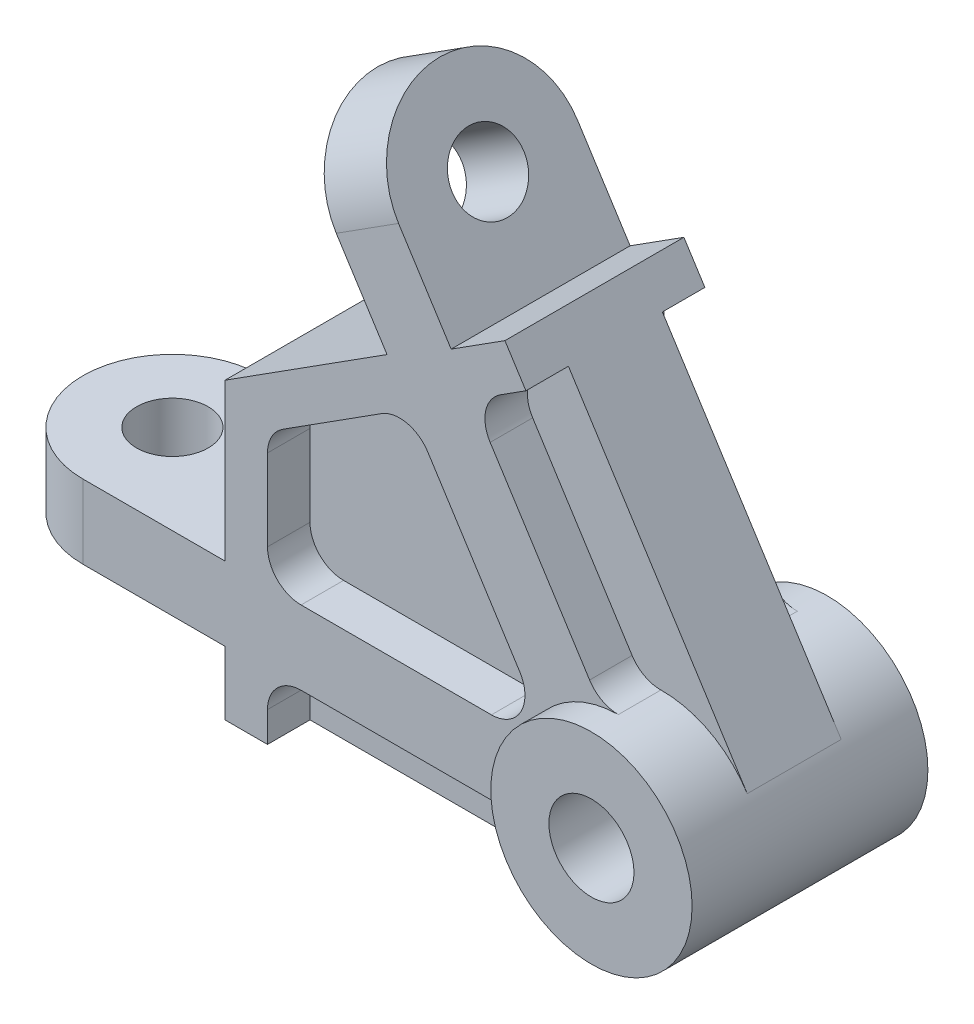
from build123d import *

# Parameters (mm, degrees)
SKETCH1_R               = 9.499999999999995
BOSS_EXTRUDE1_DEPTH     = 26.35
BOSS_EXTRUDE2_DEPTH     = 20
BOSS_EXTRUDE3_DEPTH     = 10.5
CUT_EXTRUDE1_DEPTH      = 180.89665532608137
CUT_EXTRUDE1_DEPTH_BACK = 180.89665532608137
SKETCH2_R               = 7.999999999999998
CUT_EXTRUDE2_DEPTH      = 183.77082750646198
CUT_EXTRUDE2_DEPTH_BACK = 183.77082750646198
SKETCH4_R               = 7.999999999999996


with BuildPart() as part:
    # Sketch1 → Boss-Extrude1 (new, symmetric)
    with BuildSketch(Plane.XY):
        with BuildLine():
            ThreePointArc((22.5, 0), (21.601121723683402, 6.296152815697305), (18.976307530789946, 12.089241187803507))
            ThreePointArc((18.976307530789946, 12.089241187803507), (10.67878079531028, 19.804384381386672), (-0.3266186383022837, 22.49762921432197))
            ThreePointArc((-0.3266186383022837, 22.49762921432197), (-19.726352003418917, 10.82224730068624), (-19.14980009686784, -11.812500000000023))
            ThreePointArc((-19.149800096867843, -11.812500000000012), (-10.965143637910074, -19.64728034614461), (-4.13e-15, -22.5))
            ThreePointArc((-4.13e-15, -22.5), (15.909902576697315, -15.909902576697323), (22.5, -5.51e-15))
        make_face()
        Circle(SKETCH1_R, mode=Mode.SUBTRACT)
    extrude(amount=BOSS_EXTRUDE1_DEPTH, both=True)

    # Sketch1<3> → Boss-Extrude2 (add, symmetric)
    with BuildSketch(Plane.XY):
        with BuildLine():
            Line((-26.68811354451123, 71.20520110937484), (-20.99522128527427, 74.83197346571588))
            Line((-20.995221285274297, 74.83197346571585), (-25.68506516240018, 82.19355375857313))
            Line((-25.68506516240017, 82.19355375857313), (-37.70339326523374, 74.53703433963095))
            Line((-37.70339326523374, 74.53703433963095), (-60.20447161539646, 109.85665249547212))
            Line((-60.20447161539646, 109.85665249547212), (-74.12043047130908, 100.99120895774956))
            Line((-74.12043047130908, 100.99120895774956), (-52.033854523315306, 66.32222924427353))
            Line((-52.033854523315306, 66.32222924427353), (-88.25, 43.25))
            Line((-88.25, 43.25), (-88.25000000000001, 8.249999999999986))
            Line((-88.25000000000001, 8.24999999999999), (-140, 8.249999999999982))
            Line((-140, 8.249999999999982), (-140, -8.250000000000018))
            Line((-140, -8.250000000000018), (-88.25000000000001, -8.25000000000001))
            Line((-88.25000000000001, -8.25000000000001), (-88.24999999999999, -22.5))
            Line((-88.24999999999999, -22.5), (-78.74999999999999, -22.5))
            Line((-78.74999999999999, -22.5), (-78.75, -15.750000000000018))
            ThreePointArc((-78.75, -15.750000000000018), (-76.5533008588991, -10.44669914110092), (-71.25000000000001, -8.250000000000018))
            Line((-71.25000000000001, -8.250000000000018), (-25.533066795823785, -8.250000000000018))
            ThreePointArc((-25.53306679582379, -8.250000000000018), (-21.878018916520432, -9.200906551285149), (-19.149800096867843, -11.812500000000014))
            ThreePointArc((-19.14980009686784, -11.812500000000023), (-19.726352003418917, 10.82224730068624), (-0.3266186383022837, 22.49762921432197))
            ThreePointArc((-0.3266186383022812, 22.497629214321968), (-3.99508511617313, 23.395377491967075), (-6.7609273613330165, 25.967091889828126))
            Line((-6.760927361333014, 25.967091889828126), (-28.98380232550672, 60.850018203177015))
            ThreePointArc((-28.983802325506723, 60.850018203177015), (-29.980586535309566, 66.50306237031397), (-26.688113544511225, 71.20520110937484))
        make_face()
        with BuildLine():
            ThreePointArc((-53.25494408761715, 54.28026344644994), (-47.60189992048019, 55.27704765625279), (-42.89976118141933, 51.98457466545446))
            Line((-42.89976118141933, 51.98457466545446), (-22.38302326120931, 19.77974706260116))
            ThreePointArc((-22.383023261209313, 19.77974706260116), (-22.13300843699966, 12.142584233104584), (-28.70845910480596, 8.25))
            Line((-28.70845910480596, 8.249999999999998), (-71.25000000000001, 8.249999999999991))
            ThreePointArc((-71.25000000000001, 8.249999999999993), (-76.55330085889912, 10.446699141100883), (-78.75, 15.749999999999993))
            Line((-78.75, 15.749999999999993), (-78.75, 33.92348062734661))
            ThreePointArc((-78.75, 33.92348062734661), (-77.82545066780631, 37.53089639424201), (-75.27974706260119, 40.24891647094325))
            Line((-75.27974706260119, 40.24891647094325), (-53.25494408761715, 54.28026344644994))
        make_face(mode=Mode.SUBTRACT)
    extrude(amount=BOSS_EXTRUDE2_DEPTH, both=True)

    # Sketch1<4> → Boss-Extrude3 (add, symmetric)
    with BuildSketch(Plane.XY):
        with BuildLine():
            ThreePointArc((-0.3266186383022837, 22.49762921432197), (10.67878079531028, 19.804384381386672), (18.976307530789946, 12.089241187803507))
            Line((18.976307530789953, 12.08924118780351), (-20.995221285274297, 74.83197346571585))
            Line((-20.99522128527427, 74.83197346571588), (-26.68811354451123, 71.20520110937484))
            ThreePointArc((-26.688113544511225, 71.20520110937484), (-29.980586535309566, 66.50306237031397), (-28.983802325506723, 60.850018203177015))
            Line((-28.98380232550672, 60.850018203177015), (-6.760927361333014, 25.967091889828126))
            ThreePointArc((-6.7609273613330165, 25.967091889828126), (-3.99508511617313, 23.395377491967075), (-0.3266186383022812, 22.497629214321968))
        make_face()
        with BuildLine():
            Line((-78.74999999999999, -22.5), (0, -22.5))
            ThreePointArc((-4.13e-15, -22.5), (-10.965143637910074, -19.64728034614461), (-19.149800096867843, -11.812500000000012))
            ThreePointArc((-19.149800096867843, -11.812500000000014), (-21.878018916520432, -9.200906551285149), (-25.53306679582379, -8.250000000000018))
            Line((-25.533066795823785, -8.250000000000018), (-71.25000000000001, -8.250000000000018))
            ThreePointArc((-71.25000000000001, -8.250000000000018), (-76.5533008588991, -10.44669914110092), (-78.75, -15.750000000000018))
            Line((-78.75, -15.750000000000018), (-78.74999999999999, -22.5))
        make_face()
        with BuildLine():
            Line((-22.38302326120931, 19.77974706260116), (-42.89976118141933, 51.98457466545446))
            ThreePointArc((-42.89976118141933, 51.98457466545446), (-47.60189992048019, 55.27704765625279), (-53.25494408761715, 54.28026344644994))
            Line((-53.25494408761715, 54.28026344644994), (-75.27974706260119, 40.24891647094325))
            ThreePointArc((-75.27974706260119, 40.24891647094325), (-77.82545066780631, 37.53089639424201), (-78.75, 33.92348062734661))
            Line((-78.75, 33.92348062734661), (-78.75, 15.749999999999993))
            ThreePointArc((-78.75, 15.749999999999993), (-76.55330085889912, 10.446699141100883), (-71.25000000000001, 8.249999999999993))
            Line((-71.25000000000001, 8.249999999999991), (-28.70845910480596, 8.249999999999998))
            ThreePointArc((-28.70845910480596, 8.25), (-22.13300843699966, 12.142584233104584), (-22.383023261209313, 19.77974706260116))
        make_face()
    extrude(amount=BOSS_EXTRUDE3_DEPTH, both=True)

    # Sketch2 → Cut-Extrude1 (cut, two sides: drawn at the far end of the back side and taken through both)
    with BuildSketch(Plane(origin=(0, 0, 0), x_dir=(1, 0, 0), z_dir=(0, 1, 0)).offset(-CUT_EXTRUDE1_DEPTH_BACK)):
        with BuildLine():
            Line((-140, -20), (-120, -20))
            ThreePointArc((-120, -20), (-134.142135661811, -14.142135585650896), (-140, 1.077066557e-07))
            Line((-140, 1.0770665426e-07), (-140, -20))
        make_face()
        with BuildLine():
            ThreePointArc((-140, 1.077066557e-07), (-134.1421355856509, 14.142135661811004), (-120, 20))
            Line((-120, 20.000000000000004), (-140, 20))
            Line((-140, 20), (-140, 1.0770665426e-07))
        make_face()
        with Locations((-120, 0)):
            Circle(SKETCH2_R)
    extrude(amount=CUT_EXTRUDE1_DEPTH + CUT_EXTRUDE1_DEPTH_BACK, mode=Mode.SUBTRACT)

    # Sketch4 → Cut-Extrude2 (cut, two sides: drawn at the far end of the back side and taken through both)
    with BuildSketch(Plane(origin=(6.957979427956333, 4.432721768861295, 0), x_dir=(0, 0, -1), z_dir=(0.8433914458128867, 0.5372996083468223, 0)).offset(-CUT_EXTRUDE2_DEPTH_BACK)):
        with Locations((1.532e-14, 105)):
            Circle(SKETCH4_R)
        with BuildLine():
            ThreePointArc((-4.308254075e-08, 125), (14.142135608498972, 119.14213563896293), (20, 105))
            Line((20, 105), (20, 125))
            Line((20, 125), (-4.30825402e-08, 125))
        make_face()
        with BuildLine():
            ThreePointArc((-20, 105), (-14.142135638962932, 119.14213560849896), (-4.308254075e-08, 125))
            Line((-4.30825402e-08, 125), (-20, 125))
            Line((-20, 125), (-19.999999999999996, 105))
        make_face()
    extrude(amount=CUT_EXTRUDE2_DEPTH + CUT_EXTRUDE2_DEPTH_BACK, mode=Mode.SUBTRACT)


solid = part.part
